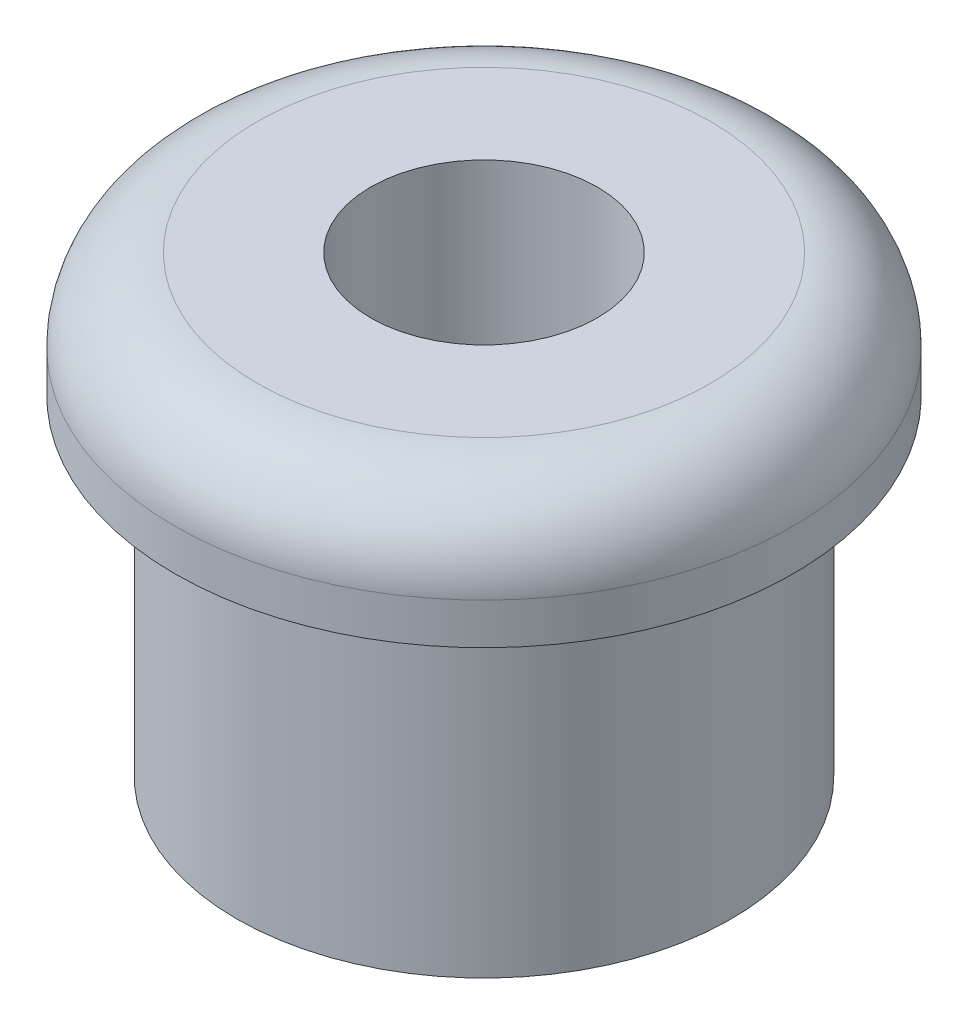
from build123d import *

# Parameters (mm, degrees)
SKETCH1_R           = 6
SKETCH1_R_2         = 2.75
BOSS_EXTRUDE1_DEPTH = 8
SKETCH2_R           = 7.5
SKETCH2_R_2         = 2.75
BOSS_EXTRUDE2_DEPTH = 3
FILLET1_R           = 2


with BuildPart() as part:
    # Sketch1 → Boss-Extrude1 (new body)
    with BuildSketch(Plane(origin=(0, 0, 0), x_dir=(1, 0, 0), z_dir=(0, 1, 0))):
        with Locations(Location((0, 0, 0), (0, 0, 270))):
            Circle(SKETCH1_R)
        with Locations(Location((0, 0, 0), (0, 0, 270))):
            Circle(SKETCH1_R_2, mode=Mode.SUBTRACT)
    extrude(amount=BOSS_EXTRUDE1_DEPTH)

    # Sketch2 → Boss-Extrude2 (add)
    with BuildSketch(Plane(origin=(0, 8, 0), x_dir=(1, 0, 0), z_dir=(0, 1, 0))):
        with Locations(Location((0, 0, 0), (0, 0, 270))):
            Circle(SKETCH2_R)
        with Locations(Location((0, 0, 0), (0, 0, 270))):
            Circle(SKETCH2_R_2, mode=Mode.SUBTRACT)
    extrude(amount=BOSS_EXTRUDE2_DEPTH)

    # Fillet1
    fillet1_edges = [part.edges().sort_by_distance(p)[0] for p in [
        (0, 11, -7.5),
    ]]
    fillet(fillet1_edges, radius=FILLET1_R)


solid = part.part
